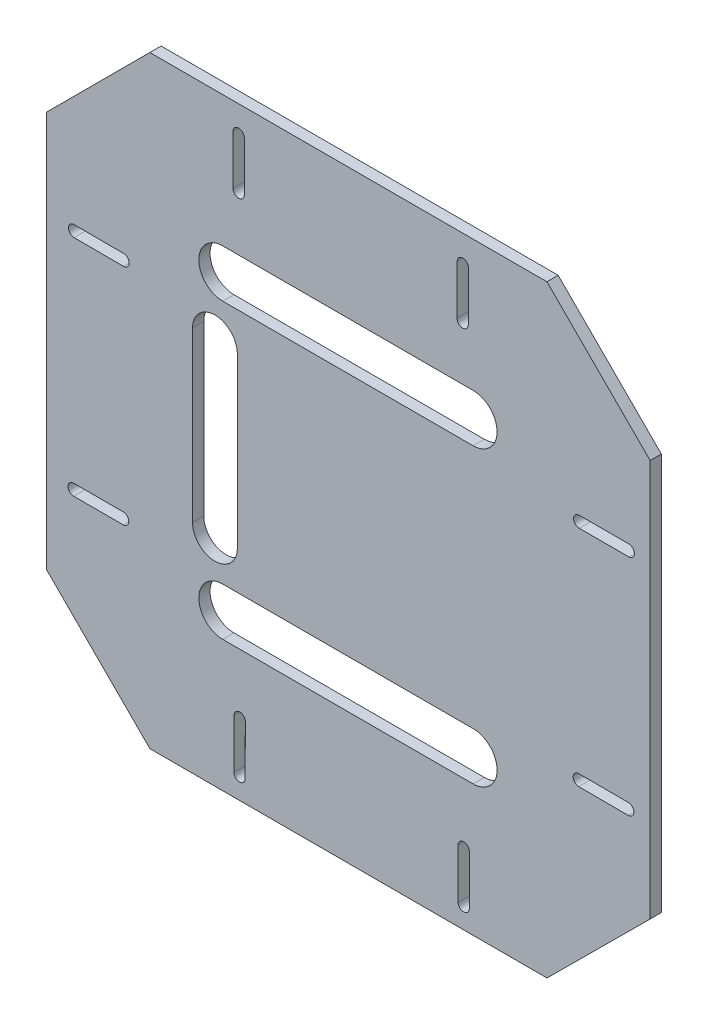
from build123d import *

# Parameters (mm, degrees)
BOSS_EXTRUDE2_DEPTH = 4


with BuildPart() as part:
    # Sketch1 → Boss-Extrude2 (new body)
    with BuildSketch(Plane.XY):
        Polygon((-73.597643579, 117.281365478), (67.863251178, 117.281365478), (104.632803799, 80.511812856), (104.632803799, -60.949081901), (67.894125273, -97.50252168), (-73.566769484, -97.50252168), (-110.367196201, -60.702096755), (-110.367196201, 80.511812856), align=None)
        with BuildLine():
            Line((-47.610288665, 70.602021163), (41.576775637, 70.602021163))
            ThreePointArc((41.576775637, 70.602021163), (50.108558427, 62.070238373), (41.576775637, 53.538455583))
            Line((41.576775637, 53.538455583), (-47.610288665, 53.538455583))
            ThreePointArc((-47.610288665, 53.538455583), (-56.142071455, 62.070238373), (-47.610288665, 70.602021163))
        make_face(mode=Mode.SUBTRACT)
        with BuildLine():
            Line((-47.610288665, -50.792305062), (41.576775637, -50.792305062))
            ThreePointArc((41.576775637, -50.792305062), (50.108558427, -42.260522272), (41.576775637, -33.728739482))
            Line((41.576775637, -33.728739482), (-47.610288665, -33.728739482))
            ThreePointArc((-47.610288665, -33.728739482), (-56.142071455, -42.260522272), (-47.610288665, -50.792305062))
        make_face(mode=Mode.SUBTRACT)
        with BuildLine():
            Line((-58.385806079, -20.095141949), (-58.385806079, 39.904858051))
            ThreePointArc((-58.385806079, 39.904858051), (-50.403357017, 47.887307113), (-42.420907955, 39.904858051))
            Line((-42.420907955, 39.904858051), (-42.420907955, -20.095141949))
            ThreePointArc((-42.420907955, -20.095141949), (-50.403357017, -28.077591011), (-58.385806079, -20.095141949))
        make_face(mode=Mode.SUBTRACT)
        with BuildLine():
            Line((-43.951300834, 90.135788358), (-43.951300834, 107.780882998))
            ThreePointArc((-43.951300834, 107.780882998), (-41.951300834, 109.780882998), (-39.951300834, 107.780882998))
            Line((-39.951300834, 107.780882998), (-39.951300834, 90.135788358))
            ThreePointArc((-39.951300834, 90.135788358), (-41.951300834, 88.135788358), (-43.951300834, 90.135788358))
        make_face(mode=Mode.SUBTRACT)
        with BuildLine():
            Line((39.83957888, 89.970561723), (39.910868679, 107.61551235))
            ThreePointArc((39.910868679, 107.61551235), (37.918965413, 109.623576437), (35.910901326, 107.63167317))
            Line((35.910901326, 107.63167317), (35.839611526, 89.986722543))
            ThreePointArc((35.839611526, 89.986722543), (37.831514793, 87.978658457), (39.83957888, 89.970561723))
        make_face(mode=Mode.SUBTRACT)
        with BuildLine():
            Line((-83.098126059, -33.179247031), (-100.743220699, -33.179247031))
            ThreePointArc((-100.743220699, -33.179247031), (-102.743220699, -31.179247031), (-100.743220699, -29.179247031))
            Line((-100.743220699, -29.179247031), (-83.098126059, -29.179247031))
            ThreePointArc((-83.098126059, -29.179247031), (-81.098126059, -31.179247031), (-83.098126059, -33.179247031))
        make_face(mode=Mode.SUBTRACT)
        with BuildLine():
            Line((-82.932899424, 50.611632682), (-100.577850051, 50.682922481))
            ThreePointArc((-100.577850051, 50.682922481), (-102.585914138, 48.691019215), (-100.594010871, 46.682955128))
            Line((-100.594010871, 46.682955128), (-82.949060244, 46.611665329))
            ThreePointArc((-82.949060244, 46.611665329), (-80.940996157, 48.603568595), (-82.932899424, 50.611632682))
        make_face(mode=Mode.SUBTRACT)
        with BuildLine():
            Line((40.21690933, -72.326072256), (40.21690933, -89.971166897))
            ThreePointArc((40.21690933, -89.971166897), (38.21690933, -91.971166897), (36.21690933, -89.971166897))
            Line((36.21690933, -89.971166897), (36.21690933, -72.326072256))
            ThreePointArc((36.21690933, -72.326072256), (38.21690933, -70.326072256), (40.21690933, -72.326072256))
        make_face(mode=Mode.SUBTRACT)
        with BuildLine():
            Line((-43.573970383, -72.160845622), (-43.645260182, -89.805796249))
            ThreePointArc((-43.645260182, -89.805796249), (-41.653356916, -91.813860335), (-39.645292829, -89.821957069))
            Line((-39.645292829, -89.821957069), (-39.574003029, -72.177006442))
            ThreePointArc((-39.574003029, -72.177006442), (-41.565906296, -70.168942355), (-43.573970383, -72.160845622))
        make_face(mode=Mode.SUBTRACT)
        with BuildLine():
            Line((79.363734556, 50.988963133), (97.008829196, 50.988963133))
            ThreePointArc((97.008829196, 50.988963133), (99.008829196, 48.988963133), (97.008829196, 46.988963133))
            Line((97.008829196, 46.988963133), (79.363734556, 46.988963133))
            ThreePointArc((79.363734556, 46.988963133), (77.363734556, 48.988963133), (79.363734556, 50.988963133))
        make_face(mode=Mode.SUBTRACT)
        with BuildLine():
            Line((79.198507921, -32.801916581), (96.843458548, -32.87320638))
            ThreePointArc((96.843458548, -32.87320638), (98.851522635, -30.881303113), (96.859619368, -28.873239027))
            Line((96.859619368, -28.873239027), (79.214668741, -28.801949227))
            ThreePointArc((79.214668741, -28.801949227), (77.206604654, -30.793852494), (79.198507921, -32.801916581))
        make_face(mode=Mode.SUBTRACT)
    extrude(amount=BOSS_EXTRUDE2_DEPTH)


solid = part.part
